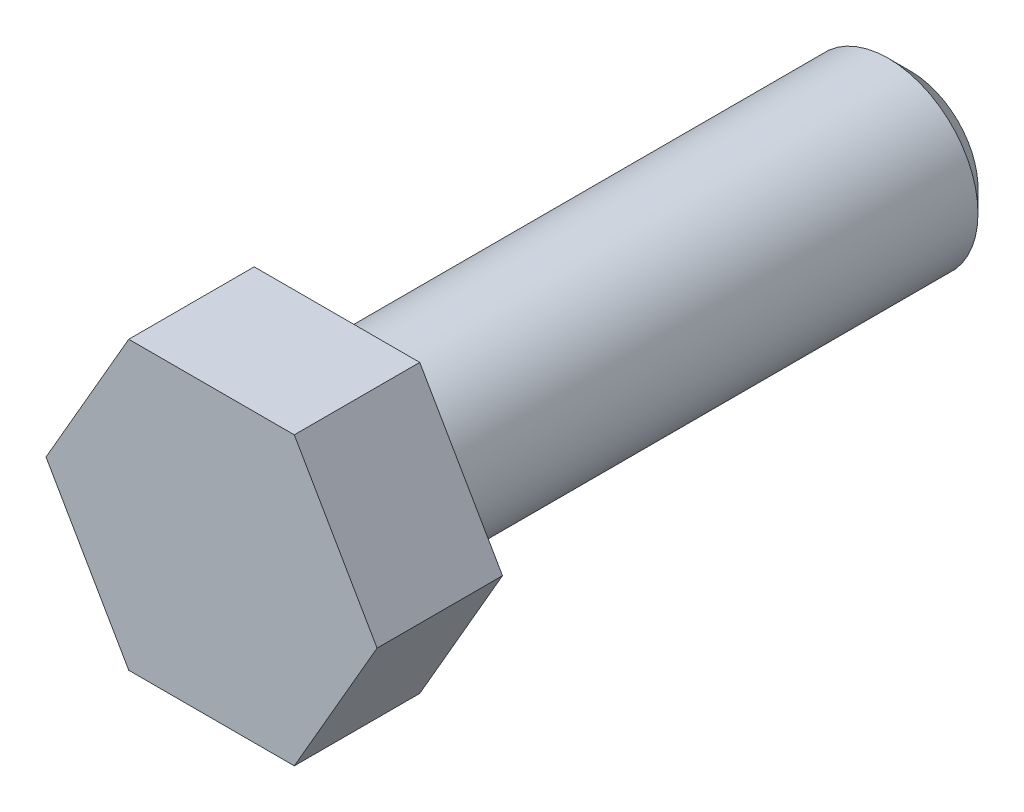
from build123d import *

# Parameters (mm, degrees)
BASE_EXTRUDE_DEPTH  = 3.5
SKETCH3_R           = 2.5
BOSS_EXTRUDE1_DEPTH = 16
CHAMFER1_SIZE       = 0.6134
FILLET1_R           = 0.25


with BuildPart() as part:
    # Sketch1 → Base-Extrude (new body)
    with BuildSketch(Plane.XY):
        Polygon((-2.309401077, 4), (2.309401077, 4), (4.618802154, 0), (2.309401077, -4), (-2.309401077, -4), (-4.618802154, 0), align=None)
    extrude(amount=BASE_EXTRUDE_DEPTH)

    # Sketch3 → Boss-Extrude1 (add)
    with BuildSketch(Plane(origin=(0, 0, 0), x_dir=(-1, 0, 0), z_dir=(0, 0, -1))):
        with Locations(Location((0, 0, 0), (0, 0, 180))):
            Circle(SKETCH3_R)
    extrude(amount=BOSS_EXTRUDE1_DEPTH)

    # Chamfer1
    chamfer1_edges = [part.edges().sort_by_distance(p)[0] for p in [
        (-2.5, 0, -16),
    ]]
    chamfer(chamfer1_edges, length=CHAMFER1_SIZE)

    # Fillet1
    fillet1_edges = [part.edges().sort_by_distance(p)[0] for p in [
        (-2.5, 0, 0),
    ]]
    fillet(fillet1_edges, radius=FILLET1_R)


solid = part.part
